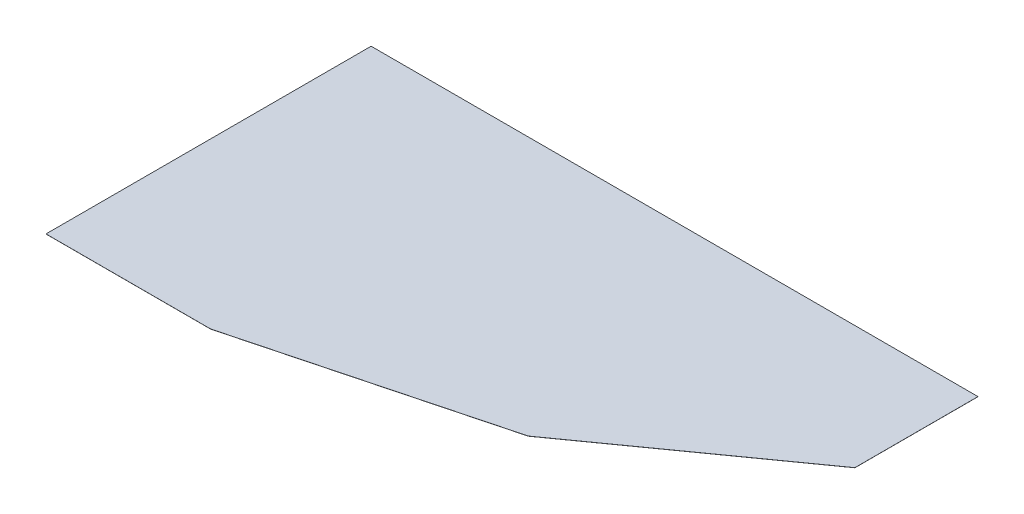
from build123d import *

# Parameters (mm, degrees)
EXTRUDE_1_DEPTH = 0.0125


with BuildPart() as part:
    # 草图1 → 凸台-拉伸1 (new, symmetric)
    with BuildSketch(Plane(origin=(0, 0, 0), x_dir=(1, 0, 0), z_dir=(0, 1, 0))):
        Polygon((0, 0), (140, 0), (140, -28.4), (96.028189696, -59.744535387), (38, -75), (0, -75), align=None)
    extrude(amount=EXTRUDE_1_DEPTH, both=True)


solid = part.part
